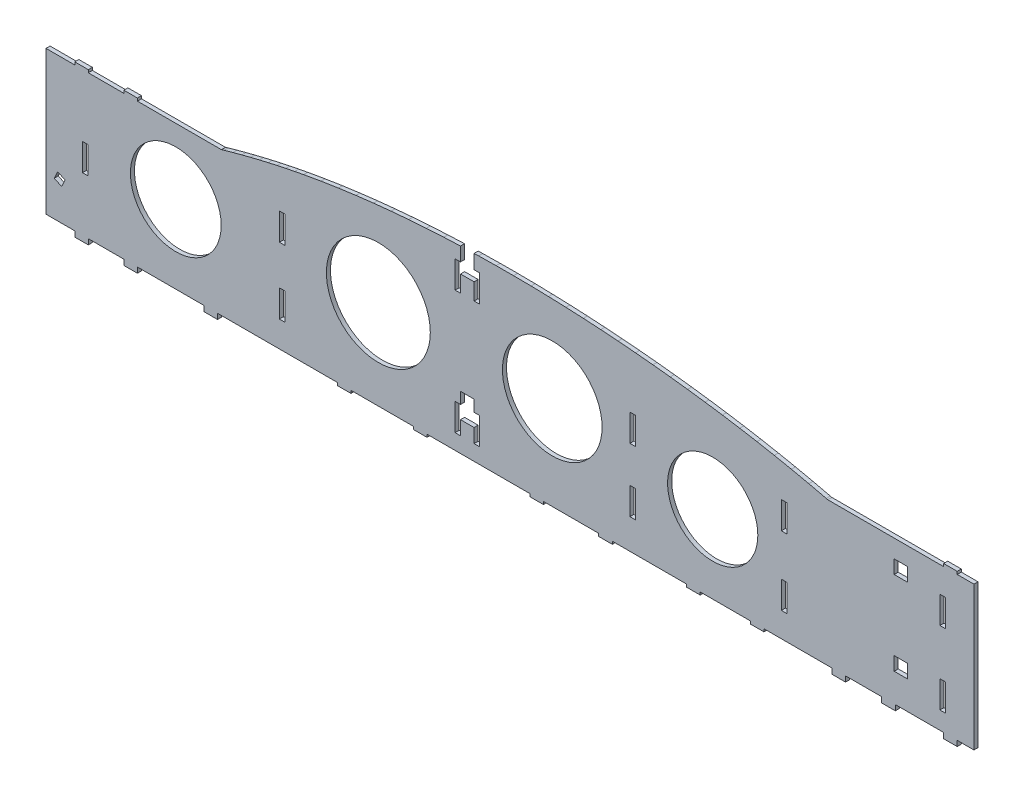
from build123d import *

# Parameters (mm, degrees)
MODEL_R         = 19.166698656
MODEL_R_2       = 18.385271544
MODEL_R_3       = 16.640009412
MODEL_R_4       = 16.752801617
MODEL_W         = 2
MODEL_H         = 10
MODEL_W_2       = 2.0625
MODEL_W_3       = 5
MODEL_H_2       = 5
EXTRUDE_1_DEPTH = 1.5


with BuildPart() as part:
    # Model → 凸台-拉伸1 (new body)
    with BuildSketch(Plane.XY):
        Polygon((331.008501053, -12.681071835), (341.616416104, -12.681071835), (341.616416104, -14.681071835), (346.616416104, -14.681071835), (346.616416104, -12.681071835), (359.731458438, -12.681071835), (359.731458438, -14.681071835), (364.731458438, -14.681071835), (364.731458438, -12.681071835), (389.285051542, -12.681071835), (389.285051542, -14.681071835), (394.285051542, -14.681071835), (394.285051542, -12.681071835), (438.527315214, -12.681071835), (438.527315214, -13.681071835), (443.527315214, -13.681071835), (443.527315214, -12.681071835), (466.595113664, -12.681071835), (466.595113664, -13.681071835), (471.595113664, -13.681071835), (471.595113664, -12.681071835), (509.543834164, -12.681071835), (509.543834164, -13.681071835), (514.543834164, -13.681071835), (514.543834164, -12.681071835), (534.941100783, -12.681071835), (534.941100783, -13.681071835), (539.941100783, -13.681071835), (539.941100783, -12.681071835), (567.393171936, -12.681071835), (567.393171936, -13.681071835), (572.393171936, -13.681071835), (572.393171936, -12.681071835), (590.909160047, -12.681071835), (590.909160047, -13.681071835), (595.909160047, -13.681071835), (595.909160047, -12.681071835), (621.009616189, -12.681071835), (621.009616189, -14.681071835), (626.009616189, -14.681071835), (626.009616189, -12.681071835), (639.352091775, -12.681071835), (639.352091775, -14.681071835), (644.352091775, -14.681071835), (644.352091775, -12.681071835), (662.203652971, -12.681071835), (662.203652971, -14.681071835), (667.203652971, -14.681071835), (667.203652971, -12.681071835), (673.375169904, -12.681071835), (673.375169904, 40.318928165), (667.203652971, 40.318928165), (667.203652971, 41.318928165), (662.203652971, 41.318928165), (662.203652971, 40.318928165), (619.461197001, 40.318928165), (618.879989346, 40.463263521), (612.469969479, 41.955284735), (606.036780234, 43.352226087), (599.689619006, 44.633304674), (593.327411645, 45.82195159), (586.94928996, 46.921207599), (580.557470145, 47.935980702), (574.151952199, 48.866270901), (567.734908698, 49.715987149), (561.30547145, 50.48817021), (554.907598578, 51.180900831), (548.503413488, 51.797834645), (542.093915228, 52.338928034), (535.680059227, 52.803138329), (529.259803769, 53.18955372), (522.834147903, 53.498130589), (516.404003437, 53.72682722), (509.962377034, 53.875948948), (503.521170035, 53.942974245), (497.0802952, 53.925905013), (490.639752529, 53.824741253), (488.943859674, 53.774868005), (488.943859674, 48.550761193), (490.943859674, 48.550761193), (490.943859674, 38.550761193), (488.943859674, 38.550761193), (488.943859674, 44.701347368), (483.943859674, 44.701347368), (483.943859674, 38.550761193), (481.943859674, 38.550761193), (481.943859674, 48.550761193), (483.943859674, 48.550761193), (483.943859674, 53.624339658), (477.764179108, 53.358922521), (471.328973881, 52.990271357), (464.822470484, 52.524637869), (458.325635443, 51.959487936), (451.839336947, 51.291780793), (445.366397665, 50.51738939), (438.908510356, 49.62923315), (432.467542259, 48.62422769), (426.046316041, 47.498245959), (422.774988305, 46.874345456), (419.510213514, 46.217127406), (416.253034336, 45.527547239), (413.004318963, 44.80256419), (409.762156535, 44.044263594), (406.528457911, 43.250560117), (403.303179471, 42.420454711), (400.000268013, 41.531679768), (396.709598454, 40.602332225), (395.753608128, 40.318928165), (364.731458438, 40.318928165), (364.731458438, 41.318928165), (359.731458438, 41.318928165), (359.731458438, 40.318928165), (346.616416104, 40.318928165), (346.616416104, 41.318928165), (341.616416104, 41.318928165), (341.616416104, 40.318928165), (331.008501053, 40.318928165), align=None)
        with Locations((453.628632303, 20.416282665)):
            Circle(MODEL_R, mode=Mode.SUBTRACT)
        with Locations((517.796175226, 21.864038252)):
            Circle(MODEL_R_2, mode=Mode.SUBTRACT)
        with Locations((576.99591729, 16.073011283)):
            Circle(MODEL_R_3, mode=Mode.SUBTRACT)
        with Locations((378.89019282, 16.048912753)):
            Circle(MODEL_R_4, mode=Mode.SUBTRACT)
        Polygon((334.054616565, 0.346826696), (335.34950157, 3.052981316), (338.055656189, 1.758096311), (336.760771185, -0.948058308), align=None, mode=Mode.SUBTRACT)
        Polygon((488.943859674, 7.212935553), (483.943859674, 7.212935553), (483.943859674, 3.001809248), (481.943859674, 3.001809248), (481.943859674, -6.998190752), (483.943859674, -6.998190752), (483.943859674, -1.850844057), (488.943859674, -1.850844057), (488.943859674, -6.998190752), (490.943859674, -6.998190752), (490.943859674, 3.001809248), (488.943859674, 3.001809248), align=None, mode=Mode.SUBTRACT)
        with Locations((418.104897365, 1.876528165)):
            Rectangle(MODEL_W, MODEL_H, mode=Mode.SUBTRACT)
        with Locations((547.437658193, 3.401778165)):
            Rectangle(MODEL_W, MODEL_H, mode=Mode.SUBTRACT)
        with Locations((603.344317775, 1.378728165)):
            Rectangle(MODEL_W_2, MODEL_H, mode=Mode.SUBTRACT)
        with Locations((345.447391947, 12.318928165)):
            Rectangle(MODEL_W, MODEL_H, mode=Mode.SUBTRACT)
        with Locations((418.104897365, 26.426650996)):
            Rectangle(MODEL_W, MODEL_H, mode=Mode.SUBTRACT)
        with Locations((547.437658193, 26.823552615)):
            Rectangle(MODEL_W, MODEL_H, mode=Mode.SUBTRACT)
        with Locations((603.313067775, 26.823552615)):
            Rectangle(MODEL_W, MODEL_H, mode=Mode.SUBTRACT)
        with Locations((661.824145294, 25.818928165)):
            Rectangle(MODEL_W, MODEL_H, mode=Mode.SUBTRACT)
        with Locations((661.824145294, -1.181071835)):
            Rectangle(MODEL_W, MODEL_H, mode=Mode.SUBTRACT)
        with Locations((646.443859674, 31.16888081)):
            Rectangle(MODEL_W_3, MODEL_H_2, mode=Mode.SUBTRACT)
        with Locations((646.443859674, 0.259792132)):
            Rectangle(MODEL_W_3, MODEL_H_2, mode=Mode.SUBTRACT)
    extrude(amount=EXTRUDE_1_DEPTH)


solid = part.part
